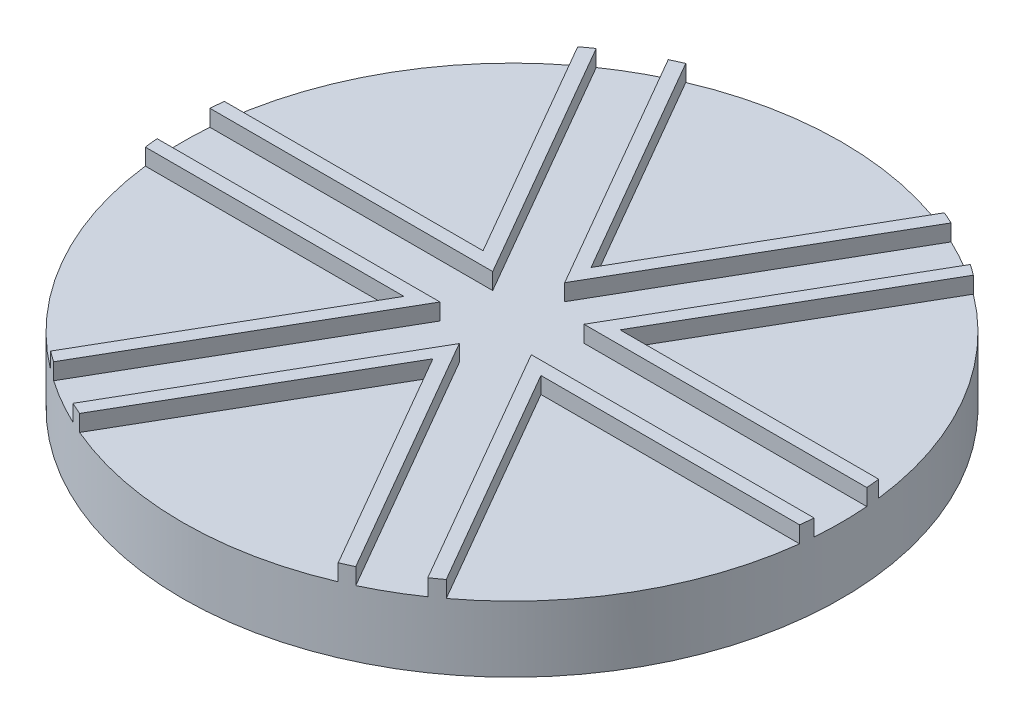
from build123d import *

# Parameters (mm, degrees)
SKETCH1_R           = 127
BOSS_EXTRUDE1_DEPTH = 25.4
BOSS_EXTRUDE2_DEPTH = 6.35


with BuildPart() as part:
    # Sketch1 → Boss-Extrude1 (new body)
    with BuildSketch(Plane(origin=(0, 0, 0), x_dir=(1, 0, 0), z_dir=(0, 1, 0))):
        with Locations(Location((0, 0, 0), (0, 0, 270))):
            Circle(SKETCH1_R)
    extrude(amount=BOSS_EXTRUDE1_DEPTH)

    # Sketch2 → Boss-Extrude2 (add)
    with BuildSketch(Plane(origin=(0, 25.4, 0), x_dir=(1, 0, 0), z_dir=(0, 1, 0))):
        with BuildLine():
            Line((-126.592947671, 10.16), (-17.597636205, 10.16))
            Line((-17.597636205, 10.16), (-72.095291938, 104.552708623))
            ThreePointArc((-72.095291938, 104.552708623), (-74.182318509, 103.082411791), (-76.239369275, 101.570461122))
            Line((-76.239369275, 101.570461122), (-26.396454307, 15.24))
            Line((-26.396454307, 15.24), (-126.082284243, 15.24))
            ThreePointArc((-126.082284243, 15.24), (-126.363146549, 12.702566445), (-126.592947671, 10.16))
        make_face()
        with BuildLine():
            Line((-126.082284243, -15.24), (-26.396454307, -15.24))
            Line((-26.396454307, -15.24), (-76.239369275, -101.570461122))
            ThreePointArc((-76.239369275, -101.570461122), (-74.182318509, -103.082411791), (-72.095291938, -104.552708623))
            Line((-72.095291938, -104.552708623), (-17.597636205, -10.16))
            Line((-17.597636205, -10.16), (-126.592947671, -10.16))
            ThreePointArc((-126.592947671, -10.16), (-126.363146549, -12.702566445), (-126.082284243, -15.24))
        make_face()
        with BuildLine():
            Line((54.497655733, -114.712708623), (0, -20.32))
            Line((0, -20.32), (-54.497655733, -114.712708623))
            ThreePointArc((-54.497655733, -114.712708623), (-52.18082804, -115.784978236), (-49.842914968, -116.810461122))
            Line((-49.842914968, -116.810461122), (0, -30.48))
            Line((0, -30.48), (49.842914968, -116.810461122))
            ThreePointArc((49.842914968, -116.810461122), (52.18082804, -115.784978236), (54.497655733, -114.712708623))
        make_face()
        with BuildLine():
            Line((76.239369275, -101.570461122), (26.396454307, -15.24))
            Line((26.396454307, -15.24), (126.082284243, -15.24))
            ThreePointArc((126.082284243, -15.24), (126.363146549, -12.702566445), (126.592947671, -10.16))
            Line((126.592947671, -10.16), (17.597636205, -10.16))
            Line((17.597636205, -10.16), (72.095291938, -104.552708623))
            ThreePointArc((72.095291938, -104.552708623), (74.182318509, -103.082411791), (76.239369275, -101.570461122))
        make_face()
        with BuildLine():
            Line((72.095291938, 104.552708623), (17.597636205, 10.16))
            Line((17.597636205, 10.16), (126.592947671, 10.16))
            ThreePointArc((126.592947671, 10.16), (126.363146549, 12.702566445), (126.082284243, 15.24))
            Line((126.082284243, 15.24), (26.396454307, 15.24))
            Line((26.396454307, 15.24), (76.239369275, 101.570461122))
            ThreePointArc((76.239369275, 101.570461122), (74.182318509, 103.082411791), (72.095291938, 104.552708623))
        make_face()
        with BuildLine():
            Line((49.842914968, 116.810461122), (0, 30.48))
            Line((0, 30.48), (-49.842914968, 116.810461122))
            ThreePointArc((-49.842914968, 116.810461122), (-52.18082804, 115.784978236), (-54.497655733, 114.712708623))
            Line((-54.497655733, 114.712708623), (0, 20.32))
            Line((0, 20.32), (54.497655733, 114.712708623))
            ThreePointArc((54.497655733, 114.712708623), (52.18082804, 115.784978236), (49.842914968, 116.810461122))
        make_face()
    extrude(amount=BOSS_EXTRUDE2_DEPTH)


solid = part.part
